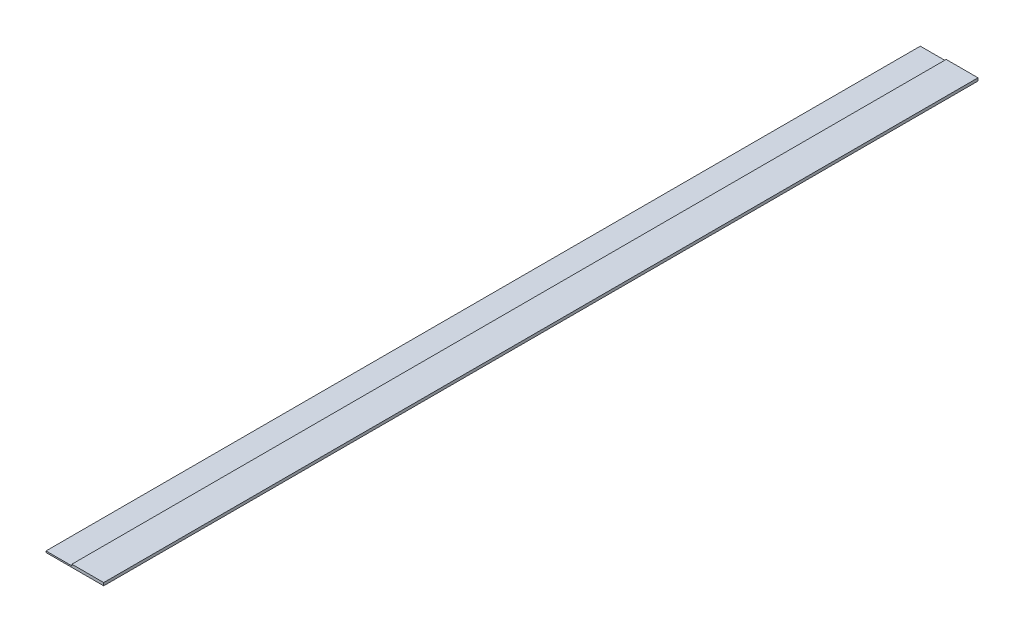
from build123d import *

# Parameters (mm, degrees)
SKETCH1_W           = 189.729626016
SKETCH1_H           = 8.695952253
BOSS_EXTRUDE1_DEPTH = 5214.4


with BuildPart() as part:
    # Sketch1 → Boss-Extrude1 (new body)
    with BuildSketch(Plane.XY.offset(5872.304177203)):
        Polygon((698.696699776, 2006.393572408), (698.696699776, 1998.07798035), (1042.858325792, 1998.07798035), (1042.858325792, 2006.393572408), (853.128699776, 2006.393572408), align=None)
        with Locations((947.993512784, 2010.741548534)):
            Rectangle(SKETCH1_W, SKETCH1_H)
    extrude(amount=-BOSS_EXTRUDE1_DEPTH)


solid = part.part
